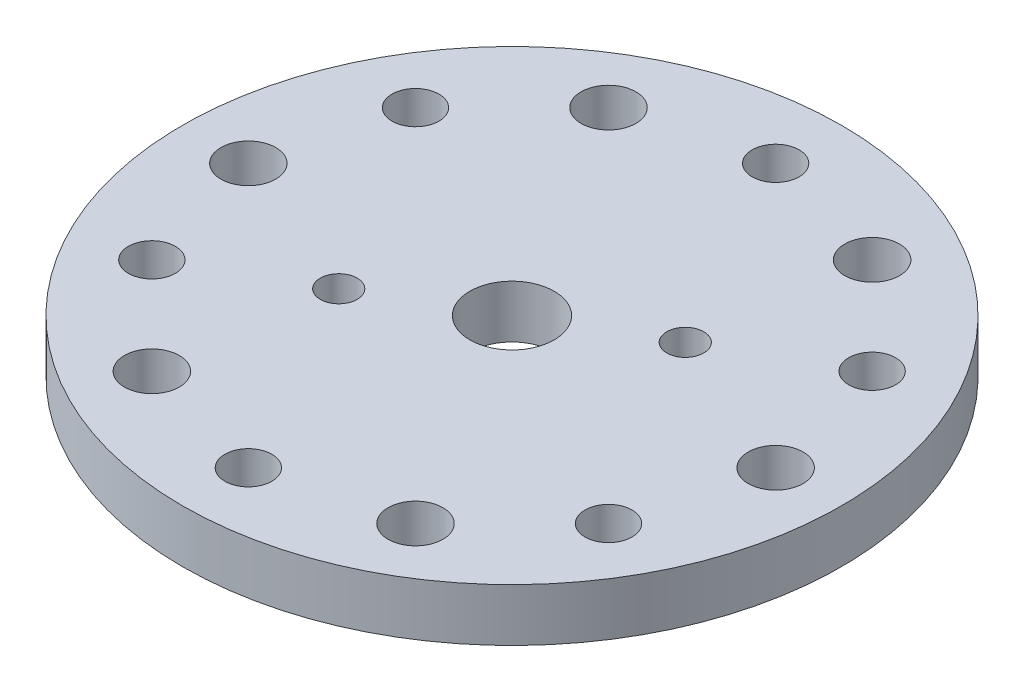
from build123d import *

# Parameters (mm, degrees)
SKETCH1_R                 = 15.875
BOSS_EXTRUDE1_DEPTH       = 2.54
TAP_DRILL_FOR_4_40_TAP1_D = 2.2606
CIRPATTERN1_COUNT         = 6
SKETCH8_R                 = 2.032
CUT_EXTRUDE1_DEPTH        = 2.54
SKETCH15_R                = 1.3208
CUT_EXTRUDE2_DEPTH        = 2.54
CIRPATTERN2_COUNT         = 6
F_2_56_TAPPED_HOLE1_D     = 1.778
F_2_56_TAPPED_HOLE2_D     = 1.778


with BuildPart() as part:
    # Sketch1 → Boss-Extrude1 (new body)
    with BuildSketch(Plane(origin=(0, 0, 0), x_dir=(1, 0, 0), z_dir=(0, 1, 0))):
        with Locations(Location((0, 0, 0), (0, 0, 270))):
            Circle(SKETCH1_R)
    extrude(amount=BOSS_EXTRUDE1_DEPTH)

    # Tap Drill for #4-40 Tap1 (through all)
    with Locations(Plane(origin=(0, 2.54, 0), x_dir=(1, 0, 0), z_dir=(0, 1, 0))):
        with Locations((0, 12.7)):
            tap_drill_for_4_40_tap1 = Hole(TAP_DRILL_FOR_4_40_TAP1_D / 2)

    # CirPattern1: Tap Drill for #4-40 Tap1 ×6 about axis
    cirpattern1_axis = Axis((0, 0, 0), (0, 1, 0))
    for i in range(1, CIRPATTERN1_COUNT):
        add(tap_drill_for_4_40_tap1.rotate(cirpattern1_axis, i * 360 / CIRPATTERN1_COUNT), mode=Mode.SUBTRACT)

    # Sketch8 → Cut-Extrude1 (cut)
    with BuildSketch(Plane(origin=(0, 2.54, 0), x_dir=(1, 0, 0), z_dir=(0, 1, 0))):
        with Locations(Location((0, 0, 0), (0, 0, 270))):
            Circle(SKETCH8_R)
    extrude(amount=-CUT_EXTRUDE1_DEPTH, mode=Mode.SUBTRACT)

    # Sketch15 → Cut-Extrude2 (cut)
    with BuildSketch(Plane(origin=(0, 2.54, 0), x_dir=(1, 0, 0), z_dir=(0, 1, 0))):
        with Locations(Location((12.7, 0, 0), (0, 0, 270))):
            Circle(SKETCH15_R)
    cut_extrude2 = extrude(amount=-CUT_EXTRUDE2_DEPTH, mode=Mode.SUBTRACT)

    # CirPattern2: Cut-Extrude2 ×6 about axis
    cirpattern2_axis = Axis((0, 0, 0), (0, 1, 0))
    for i in range(1, CIRPATTERN2_COUNT):
        add(cut_extrude2.rotate(cirpattern2_axis, i * 360 / CIRPATTERN2_COUNT), mode=Mode.SUBTRACT)

    # #2-56 Tapped Hole1 (through all)
    with Locations(Plane(origin=(0, 2.54, 0), x_dir=(1, 0, 0), z_dir=(0, 1, 0))):
        with Locations((-5.291415217, -3.055)):
            Hole(F_2_56_TAPPED_HOLE1_D / 2)

    # #2-56 Tapped Hole2 (through all)
    with Locations(Plane(origin=(0, 2.54, 0), x_dir=(1, 0, 0), z_dir=(0, 1, 0))):
        with Locations((5.291415217, 3.055)):
            Hole(F_2_56_TAPPED_HOLE2_D / 2)


solid = part.part
